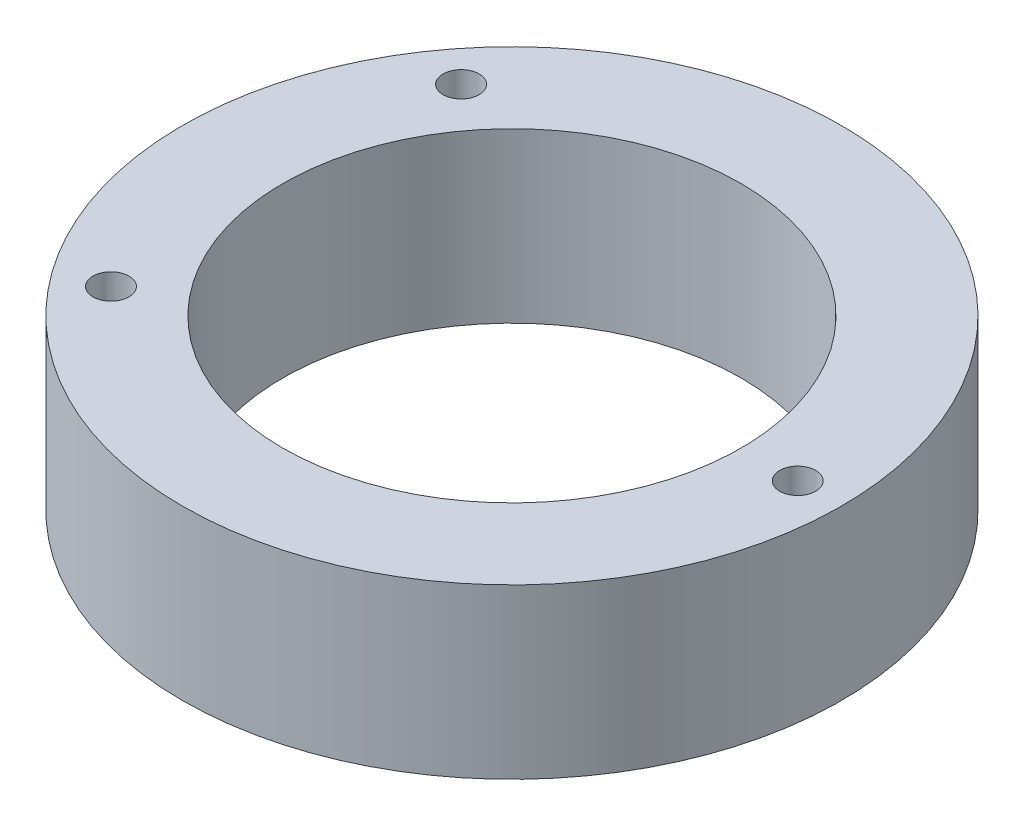
from build123d import *

# Parameters (mm, degrees)
SKETCH1_R           = 32
SKETCH1_R_2         = 22.25
SKETCH1_R_3         = 1.75
BOSS_EXTRUDE1_DEPTH = 16.35


with BuildPart() as part:
    # Sketch1 → Boss-Extrude1 (new body)
    with BuildSketch(Plane(origin=(0, 0, 0), x_dir=(1, 0, 0), z_dir=(0, 1, 0))):
        with Locations(Location((0, 0, 0), (0, 0, 270))):
            Circle(SKETCH1_R)
        with Locations(Location((0, 0, 0), (0, 0, 270))):
            Circle(SKETCH1_R_2, mode=Mode.SUBTRACT)
        with Locations(Location((27.75, 0, 0), (0, 0, 270))):
            Circle(SKETCH1_R_3, mode=Mode.SUBTRACT)
        with Locations(Location((-21.932737229, 17.000515805, 0), (0, 0, 270))):
            Circle(SKETCH1_R_3, mode=Mode.SUBTRACT)
        with Locations(Location((-21.932737229, -17.000515805, 0), (0, 0, 270))):
            Circle(SKETCH1_R_3, mode=Mode.SUBTRACT)
    extrude(amount=BOSS_EXTRUDE1_DEPTH)


solid = part.part
